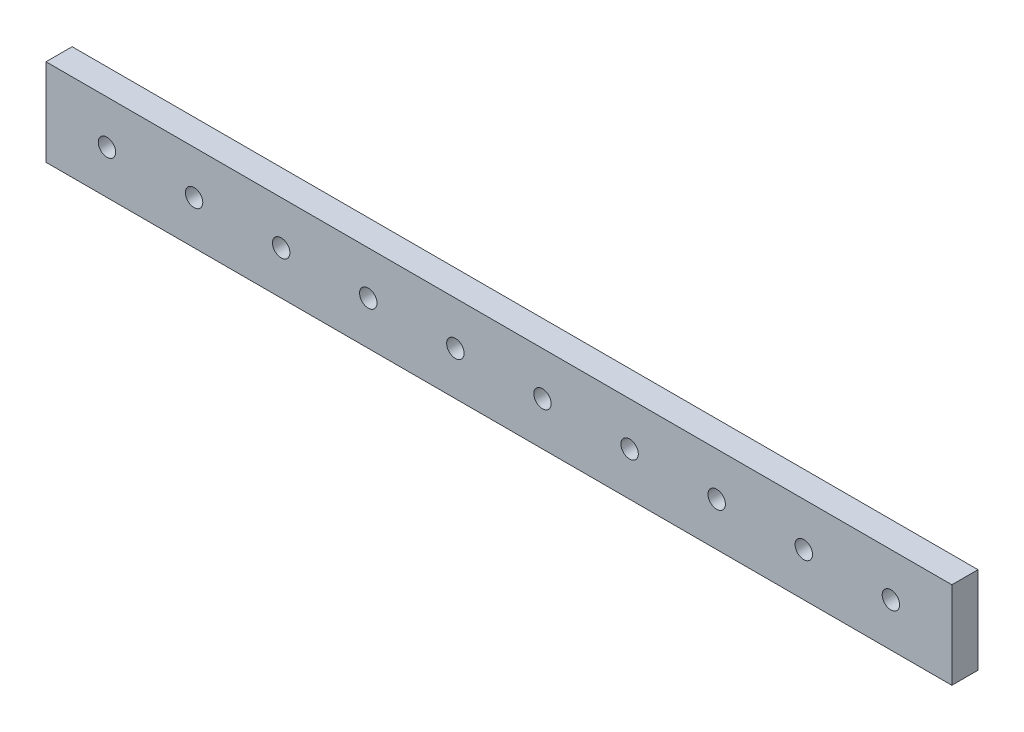
from build123d import *

# Parameters (mm, degrees)
BOSS_EXTRUDE1_DEPTH             = 15.875
BOSS_EXTRUDE1_DEPTH_BACK        = 15.875
SKETCH2_W                       = 330.2
SKETCH2_H                       = 9.525
F_1_4_0_25_DIAMETER_HOLE1_D     = 6.35
F_1_4_0_25_DIAMETER_HOLE1_DEPTH = 4.7625
F_1_4_0_25_DIAMETER_HOLE1_TIP   = 1.907732465


with BuildPart() as part:
    # Sketch2 → Boss-Extrude1 (new, two sides: drawn at the far end of the back side and taken through both)
    with BuildSketch(Plane(origin=(0, 0, 0), x_dir=(1, 0, 0), z_dir=(0, 1, 0)).offset(-BOSS_EXTRUDE1_DEPTH_BACK)):
        with Locations((0, 84.1375)):
            Rectangle(SKETCH2_W, SKETCH2_H)
    extrude(amount=BOSS_EXTRUDE1_DEPTH + BOSS_EXTRUDE1_DEPTH_BACK)

    # 1/4 (0.25) Diameter Hole1
    with Locations(Plane.XY.offset(-79.375)):
        with Locations((-142.875, 0), (-111.125, 0), (-79.375, 0), (-47.625, 0), (-15.875, 0), (15.875, 0), (47.625, 0), (79.375, 0), (111.125, 0), (142.875, 0)):
            Hole(F_1_4_0_25_DIAMETER_HOLE1_D / 2, depth=F_1_4_0_25_DIAMETER_HOLE1_DEPTH)
            with Locations((0, 0, -(F_1_4_0_25_DIAMETER_HOLE1_DEPTH + F_1_4_0_25_DIAMETER_HOLE1_TIP / 2))):  # 118° drill point
                Cone(0, F_1_4_0_25_DIAMETER_HOLE1_D / 2, F_1_4_0_25_DIAMETER_HOLE1_TIP, mode=Mode.SUBTRACT)


solid = part.part
